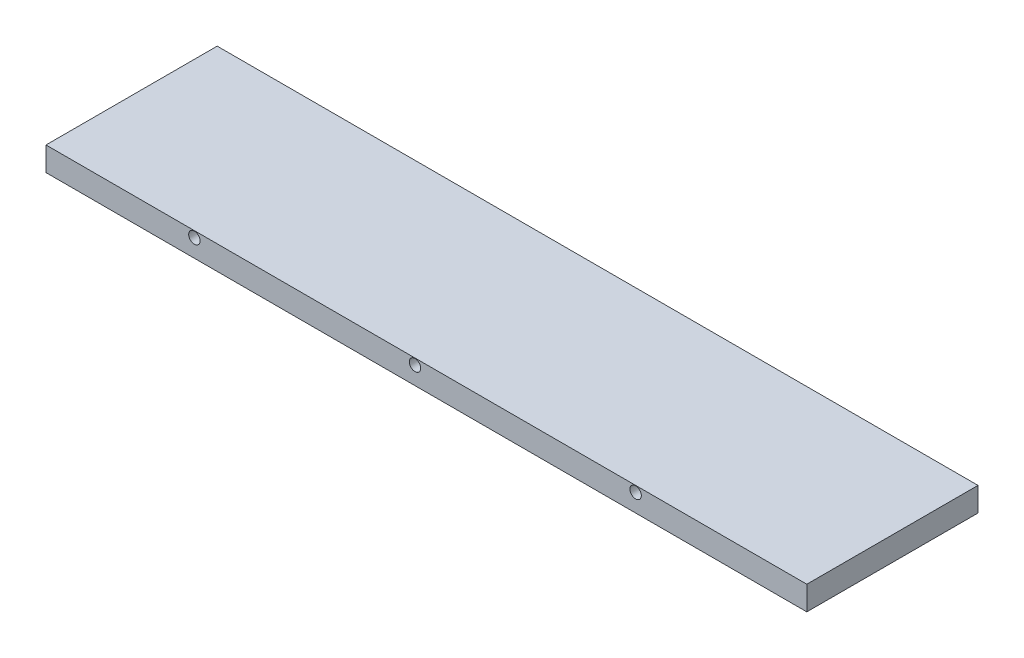
from build123d import *

# Parameters (mm, degrees)
SKETCH1_W                        = 254
SKETCH1_H                        = 57.15
SKETCH1_R                        = 10
BOSS_EXTRUDE1_DEPTH              = 8
SKETCH25_R                       = 10.25
CUT_EXTRUDE1_DEPTH               = 7.6
SKETCH26_W                       = 254
SKETCH26_H                       = 57.15
BOSS_EXTRUDE2_DEPTH              = 0.4
F_25_0_1495_DIAMETER_HOLE2_D     = 3.7973
F_25_0_1495_DIAMETER_HOLE2_DEPTH = 6.35
F_25_0_1495_DIAMETER_HOLE2_TIP   = 1.140824014
F_25_0_1495_DIAMETER_HOLE1_D     = 3.7973
F_25_0_1495_DIAMETER_HOLE1_DEPTH = 6.35
F_25_0_1495_DIAMETER_HOLE1_TIP   = 1.140824014


with BuildPart() as part:
    # Sketch1 → Boss-Extrude1 (new body)
    with BuildSketch(Plane(origin=(0, 0, 0), x_dir=(1, 0, 0), z_dir=(0, 1, 0))):
        with Locations((92.969183673, -14.086632653)):
            Rectangle(SKETCH1_W, SKETCH1_H)
        with Locations(Location((202.969183673, 0.518367347, 0), (0, 0, 270))):
            Circle(SKETCH1_R, mode=Mode.SUBTRACT)
        with Locations(Location((171.219183673, 0.518367347, 0), (0, 0, 270))):
            Circle(SKETCH1_R, mode=Mode.SUBTRACT)
        with Locations(Location((139.469183673, 0.518367347, 0), (0, 0, 270))):
            Circle(SKETCH1_R, mode=Mode.SUBTRACT)
        with Locations(Location((107.719183673, 0.518367347, 0), (0, 0, 270))):
            Circle(SKETCH1_R, mode=Mode.SUBTRACT)
        with Locations(Location((75.969183673, 0.518367347, 0), (0, 0, 270))):
            Circle(SKETCH1_R, mode=Mode.SUBTRACT)
        with Locations(Location((44.219183673, 0.518367347, 0), (0, 0, 270))):
            Circle(SKETCH1_R, mode=Mode.SUBTRACT)
        with Locations(Location((171.219183673, -22.341632653, 0), (0, 0, 270))):
            Circle(SKETCH1_R, mode=Mode.SUBTRACT)
        with Locations(Location((139.469183673, -22.341632653, 0), (0, 0, 270))):
            Circle(SKETCH1_R, mode=Mode.SUBTRACT)
        with Locations(Location((107.719183673, -22.341632653, 0), (0, 0, 270))):
            Circle(SKETCH1_R, mode=Mode.SUBTRACT)
        with Locations(Location((75.969183673, -22.341632653, 0), (0, 0, 270))):
            Circle(SKETCH1_R, mode=Mode.SUBTRACT)
        with Locations(Location((44.219183673, -22.341632653, 0), (0, 0, 270))):
            Circle(SKETCH1_R, mode=Mode.SUBTRACT)
        with Locations(Location((202.969183673, -22.341632653, 0), (0, 0, 270))):
            Circle(SKETCH1_R, mode=Mode.SUBTRACT)
        with Locations(Location((12.469183673, 0.518367347, 0), (0, 0, 270))):
            Circle(SKETCH1_R, mode=Mode.SUBTRACT)
        with Locations(Location((-19.280816327, 0.518367347, 0), (0, 0, 270))):
            Circle(SKETCH1_R, mode=Mode.SUBTRACT)
        with Locations(Location((12.469183673, -22.341632653, 0), (0, 0, 270))):
            Circle(SKETCH1_R, mode=Mode.SUBTRACT)
        with Locations(Location((-19.280816327, -22.341632653, 0), (0, 0, 270))):
            Circle(SKETCH1_R, mode=Mode.SUBTRACT)
    extrude(amount=BOSS_EXTRUDE1_DEPTH)

    # Sketch25 → Cut-Extrude1 (cut)
    with BuildSketch(Plane.XZ):
        with Locations(Location((44.219183673, 22.341632653, 0), (0, 0, 270))):
            Circle(SKETCH25_R)
        with Locations(Location((75.969183673, 22.341632653, 0), (0, 0, 270))):
            Circle(SKETCH25_R)
        with Locations(Location((107.719183673, 22.341632653, 0), (0, 0, 270))):
            Circle(SKETCH25_R)
        with Locations(Location((139.469183673, 22.341632653, 0), (0, 0, 270))):
            Circle(SKETCH25_R)
        with Locations(Location((171.219183673, 22.341632653, 0), (0, 0, 270))):
            Circle(SKETCH25_R)
        with Locations(Location((202.969183673, 22.341632653, 0), (0, 0, 270))):
            Circle(SKETCH25_R)
        with Locations(Location((75.969183673, -0.518367347, 0), (0, 0, 270))):
            Circle(SKETCH25_R)
        with Locations(Location((107.719183673, -0.518367347, 0), (0, 0, 270))):
            Circle(SKETCH25_R)
        with Locations(Location((139.469183673, -0.518367347, 0), (0, 0, 270))):
            Circle(SKETCH25_R)
        with Locations(Location((171.219183673, -0.518367347, 0), (0, 0, 270))):
            Circle(SKETCH25_R)
        with Locations(Location((202.969183673, -0.518367347, 0), (0, 0, 270))):
            Circle(SKETCH25_R)
        with Locations(Location((44.219183673, -0.518367347, 0), (0, 0, 270))):
            Circle(SKETCH25_R)
        with Locations(Location((12.469183673, 22.341632653, 0), (0, 0, 270))):
            Circle(SKETCH25_R)
        with Locations(Location((-19.280816327, 22.341632653, 0), (0, 0, 270))):
            Circle(SKETCH25_R)
        with Locations(Location((-19.280816327, -0.518367347, 0), (0, 0, 270))):
            Circle(SKETCH25_R)
        with Locations(Location((12.469183673, -0.518367347, 0), (0, 0, 270))):
            Circle(SKETCH25_R)
    extrude(amount=-CUT_EXTRUDE1_DEPTH, mode=Mode.SUBTRACT)

    # Sketch26 → Boss-Extrude2 (add)
    with BuildSketch(Plane(origin=(0, 8, 0), x_dir=(1, 0, 0), z_dir=(0, 1, 0))):
        with Locations((92.969183673, -14.086632653)):
            Rectangle(SKETCH26_W, SKETCH26_H)
    extrude(amount=-BOSS_EXTRUDE2_DEPTH)

    # #25 (0.1495) Diameter Hole2
    with Locations(Plane.XY.offset(42.661632653)):
        with Locations((15.499183673, 5.968), (162.819183673, 5.968), (89.159183673, 5.968)):
            Hole(F_25_0_1495_DIAMETER_HOLE2_D / 2, depth=F_25_0_1495_DIAMETER_HOLE2_DEPTH)
            with Locations((0, 0, -(F_25_0_1495_DIAMETER_HOLE2_DEPTH + F_25_0_1495_DIAMETER_HOLE2_TIP / 2))):  # 118° drill point
                Cone(0, F_25_0_1495_DIAMETER_HOLE2_D / 2, F_25_0_1495_DIAMETER_HOLE2_TIP, mode=Mode.SUBTRACT)

    # #25 (0.1495) Diameter Hole1
    with Locations(Plane(origin=(0, 0, -14.488367347), x_dir=(-1, 0, 0), z_dir=(0, 0, -1))):
        with Locations((-148.849183673, 4.19), (-85.349183673, 4.19), (-21.849183673, 4.19)):
            Hole(F_25_0_1495_DIAMETER_HOLE1_D / 2, depth=F_25_0_1495_DIAMETER_HOLE1_DEPTH)
            with Locations((0, 0, -(F_25_0_1495_DIAMETER_HOLE1_DEPTH + F_25_0_1495_DIAMETER_HOLE1_TIP / 2))):  # 118° drill point
                Cone(0, F_25_0_1495_DIAMETER_HOLE1_D / 2, F_25_0_1495_DIAMETER_HOLE1_TIP, mode=Mode.SUBTRACT)


solid = part.part
